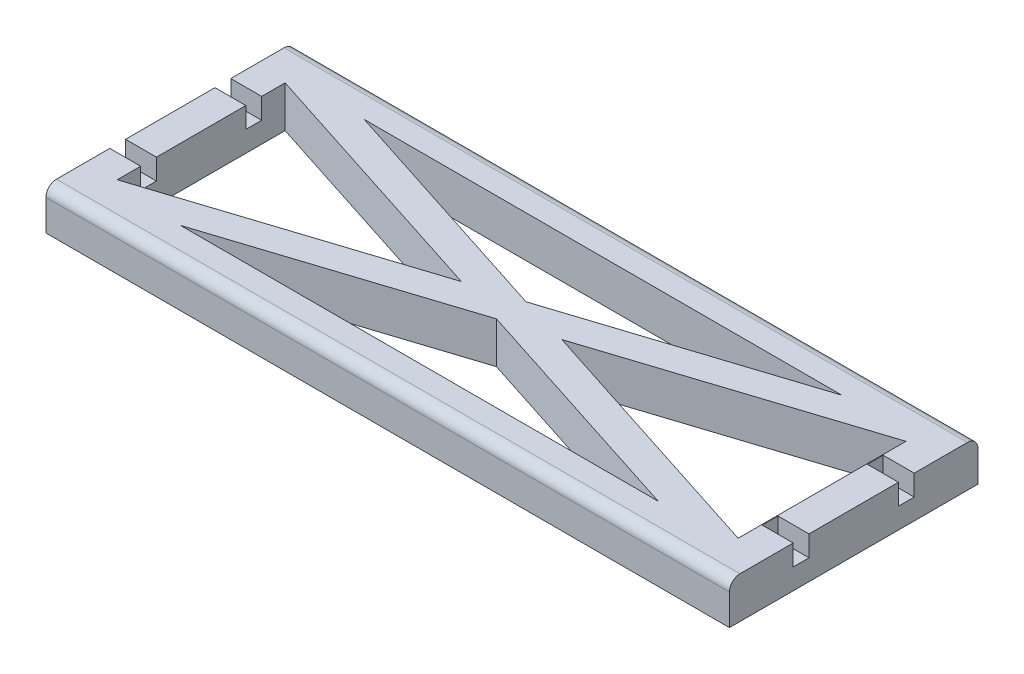
from build123d import *

# Parameters (mm, degrees)
SKETCH1_W           = 165
SKETCH1_H           = 60
BOSS_EXTRUDE1_DEPTH = 10
SKETCH2_W           = 3.81
SKETCH2_H           = 5
CUT_EXTRUDE1_DEPTH  = 7.5
FILLET1_R           = 2.54


with BuildPart() as part:
    # Sketch1 → Boss-Extrude1 (new body)
    with BuildSketch(Plane(origin=(0, 0, 0), x_dir=(1, 0, 0), z_dir=(0, 1, 0))):
        Rectangle(SKETCH1_W, SKETCH1_H)
        Polygon((-75.04, 20.262432489), (-75.04, -20.262432489), (-12.226459283, 0), align=None, mode=Mode.SUBTRACT)
        Polygon((57.460458264, 22.165834991), (-57.834623171, 22.165834991), (-0.187082453, 3.569854115), align=None, mode=Mode.SUBTRACT)
        Polygon((74.852917547, 20.262432489), (74.852917547, -20.262432489), (12.039376829, 0), align=None, mode=Mode.SUBTRACT)
        Polygon((-57.834623171, -22.165834991), (-0.187082453, -3.569854115), (57.460458264, -22.165834991), align=None, mode=Mode.SUBTRACT)
    extrude(amount=BOSS_EXTRUDE1_DEPTH)

    # Sketch2 → Cut-Extrude1 (cut)
    with BuildSketch(Plane.ZY.offset(82.5)):
        with Locations((-12.7, 7.5)):
            Rectangle(SKETCH2_W, SKETCH2_H)
        with Locations((12.7, 7.5)):
            Rectangle(SKETCH2_W, SKETCH2_H)
    cut_extrude1 = extrude(amount=-CUT_EXTRUDE1_DEPTH, mode=Mode.SUBTRACT)

    # Mirror1: Cut-Extrude1 across plane
    add(cut_extrude1.mirror(Plane(origin=(0, 0, 0), x_dir=(0, 0, 1), z_dir=(1, 0, 0))), mode=Mode.SUBTRACT)

    # Fillet1
    fillet1_edges = [part.edges().sort_by_distance(p)[0] for p in [
        (0, 10, -30),
        (0, 10, 30),
    ]]
    fillet(fillet1_edges, radius=FILLET1_R)


solid = part.part
